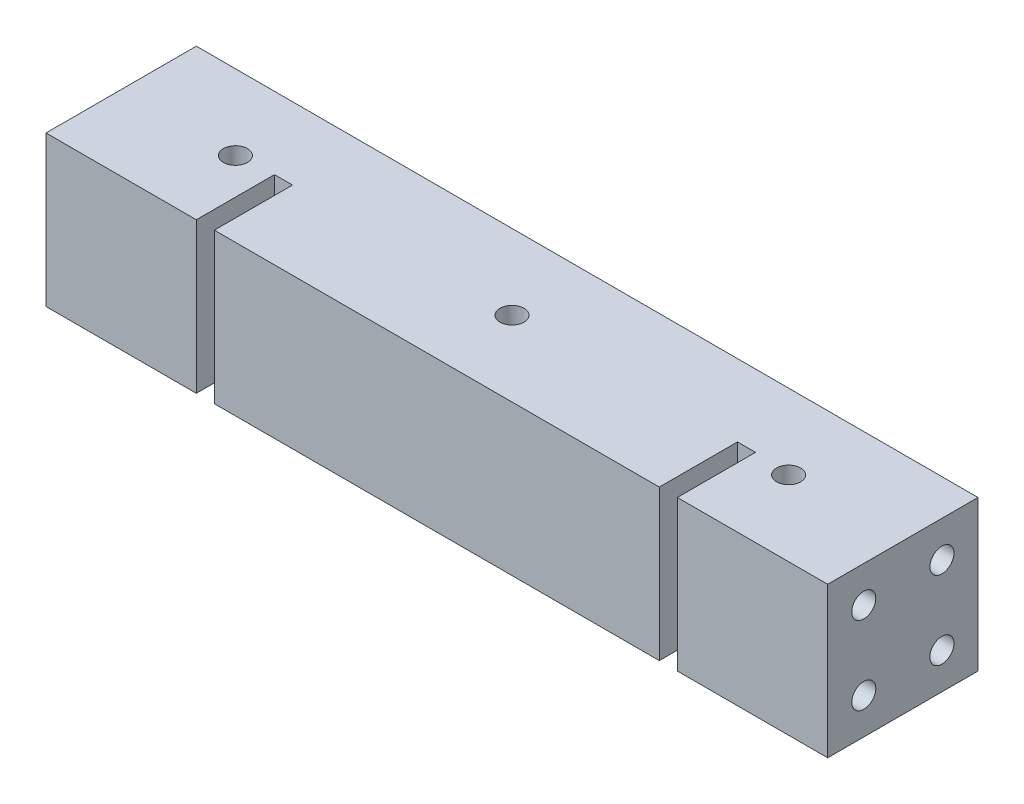
from build123d import *

# Parameters (mm, degrees)
BOSS_EXTRUDE1_DEPTH = 12.5
SKETCH2_R           = 2
CUT_EXTRUDE1_DEPTH  = 15
SKETCH3_R           = 2
CUT_EXTRUDE2_DEPTH  = 15


with BuildPart() as part:
    # Sketch1 → Boss-Extrude1 (new, symmetric)
    with BuildSketch(Plane(origin=(0, 0, 0), x_dir=(1, 0, 0), z_dir=(0, 1, 0))):
        Polygon((-65, 12.5), (65, 12.5), (65, -12.5), (40, -12.5), (40, 0.5), (37, 0.5), (37, -12.5), (-37, -12.5), (-37, 0.5), (-40, 0.5), (-40, -12.5), (-65, -12.5), align=None)
    extrude(amount=BOSS_EXTRUDE1_DEPTH, both=True)

    # Sketch2 → Cut-Extrude1 (cut)
    with BuildSketch(Plane(origin=(65, 0, 0), x_dir=(0, 0, -1), z_dir=(1, 0, 0))):
        with Locations((-6.5, 6.5)):
            Circle(SKETCH2_R)
        with Locations(Location((6.5, 6.5, 0), (0, 0, 180))):
            Circle(SKETCH2_R)
        with Locations((6.5, -6.5)):
            Circle(SKETCH2_R)
        with Locations(Location((-6.5, -6.5, 0), (0, 0, 180))):
            Circle(SKETCH2_R)
    cut_extrude1 = extrude(amount=-CUT_EXTRUDE1_DEPTH, mode=Mode.SUBTRACT)

    # Sketch3 → Cut-Extrude2 (cut)
    with BuildSketch(Plane(origin=(0, 12.5, 0), x_dir=(1, 0, 0), z_dir=(0, 1, 0))):
        with Locations(Location((46, 0, 0), (0, 0, 270))):
            Circle(SKETCH3_R)
        with Locations(Location((0, 0, 0), (0, 0, 270))):
            Circle(SKETCH3_R)
        with Locations(Location((-46, 0, 0), (0, 0, 270))):
            Circle(SKETCH3_R)
    extrude(amount=-CUT_EXTRUDE2_DEPTH, mode=Mode.SUBTRACT)

    # Mirror1: Cut-Extrude1 across plane
    add(cut_extrude1.mirror(Plane(origin=(0, 0, 0), x_dir=(0, 0, 1), z_dir=(1, 0, 0))), mode=Mode.SUBTRACT)


solid = part.part
